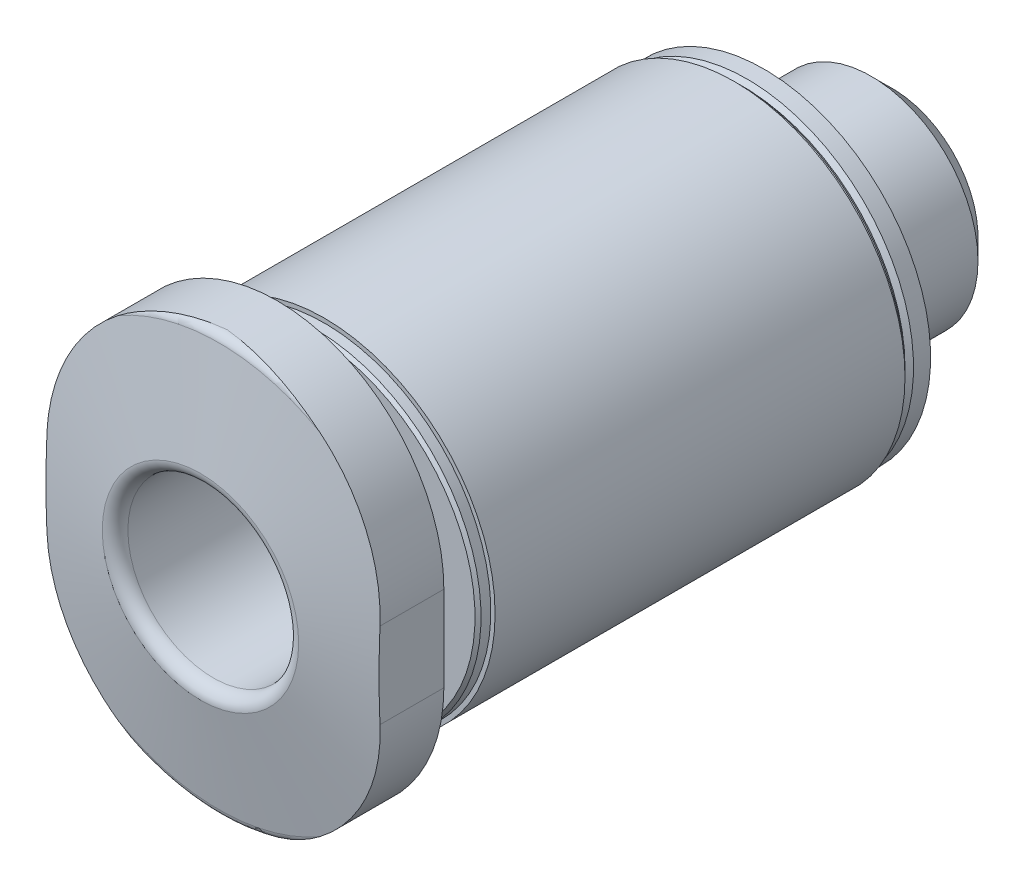
from build123d import *

# Parameters (mm, degrees)
CUT_EXTRUDE1_DEPTH = 4.7
SKETCH3_W          = 20
SKETCH3_H          = 20
CUT_EXTRUDE2_DEPTH = 2


with BuildPart() as part:
    # Sketch1 → Revolve1 (revolve)
    with BuildSketch(Plane(origin=(0, 0, 0), x_dir=(0, 0, -1), z_dir=(1, 0, 0)), mode=Mode.PRIVATE) as revolve1_sk:
        with BuildLine():
            Line((-1.7, 0), (-1.7, 2))
            Line((-1.7, 2), (-12.9, 2))
            ThreePointArc((-12.9, 2), (-13.112132034, 2.087867966), (-13.2, 2.3))
            Line((-13.2, 2.3), (-12.770691475, 4.734729636))
            ThreePointArc((-12.770691475, 4.734729636), (-12.702287446, 4.853208889), (-12.573729924, 4.9))
            Line((-12.573729924, 4.9), (-11.4, 4.9))
            Line((-11.4, 4.9), (-11.4, 3.075))
            ThreePointArc((-11.4, 3.075), (-11.290165043, 2.809834957), (-11.025, 2.7))
            Line((-11.025, 2.7), (-10.6, 2.7))
            Line((-10.6, 2.7), (-10.6, 3.829289322))
            Line((-10.6, 3.829289322), (-10.529289322, 3.9))
            Line((-10.529289322, 3.9), (-10.3, 3.9))
            Line((-10.3, 3.9), (-10.3, 4))
            Line((-10.3, 4), (-0.7, 4))
            Line((-0.7, 4), (-0.7, 3.9))
            Line((-0.7, 3.9), (-0.6, 3.9))
            Line((-0.6, 3.9), (-0.5, 3.8))
            Line((-0.5, 3.8), (-0.4, 3.9))
            Line((-0.4, 3.9), (0, 3.9))
            Line((0, 3.9), (0, 2.5))
            Line((0, 2.5), (2.5095, 2.5))
            Line((2.5095, 2.5), (3, 2.0095))
            Line((3, 2.0095), (3, 0))
            Line((3, 0), (-1.7, 0))
        make_face()
    revolve(revolve1_sk.sketch.rotate(Axis((0, 0, -3), (0, 0, 1)), 90), axis=Axis((0, 0, -3), (0, 0, 1)))

    # Sketch2 → Cut-Extrude1 (cut)
    with BuildSketch(Plane.XY.offset(-3)):
        Polygon((-1.25, -0.721687836), (0, -1.443375673), (1.25, -0.721687836), (1.25, 0.721687836), (0, 1.443375673), (-1.25, 0.721687836), align=None)
    extrude(amount=CUT_EXTRUDE1_DEPTH, mode=Mode.SUBTRACT)

    # Sketch3 → Cut-Extrude2 (cut)
    with BuildSketch(Plane.XY.offset(13.2)):
        Rectangle(SKETCH3_W, SKETCH3_H)
        with BuildLine():
            Line((-3.9, 1), (-3.9, -1))
            ThreePointArc((-3.9, -1), (0, -4.899999854), (3.9, -1))
            Line((3.9, -1), (3.9, 1))
            ThreePointArc((3.9, 1), (0, 4.9), (-3.9, 1))
        make_face(mode=Mode.SUBTRACT)
    extrude(amount=-CUT_EXTRUDE2_DEPTH, mode=Mode.SUBTRACT)


solid = part.part
